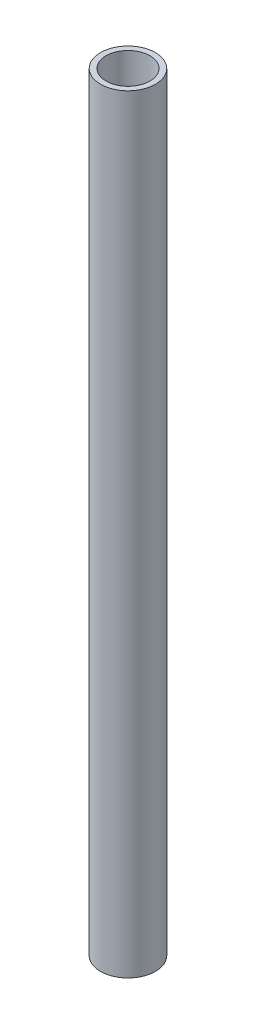
from build123d import *

# Parameters (mm, degrees)
SKETCH1_R           = 0.25
SKETCH1_R_2         = 0.2
BOSS_EXTRUDE1_DEPTH = 7


with BuildPart() as part:
    # Sketch1 → Boss-Extrude1 (new body)
    with BuildSketch(Plane(origin=(0, 0, 0), x_dir=(1, 0, 0), z_dir=(0, 1, 0))):
        with Locations(Location((0, 0, 0), (0, 0, 270))):
            Circle(SKETCH1_R)
        with Locations(Location((0, 0, 0), (0, 0, 270))):
            Circle(SKETCH1_R_2, mode=Mode.SUBTRACT)
    extrude(amount=BOSS_EXTRUDE1_DEPTH)


solid = part.part
